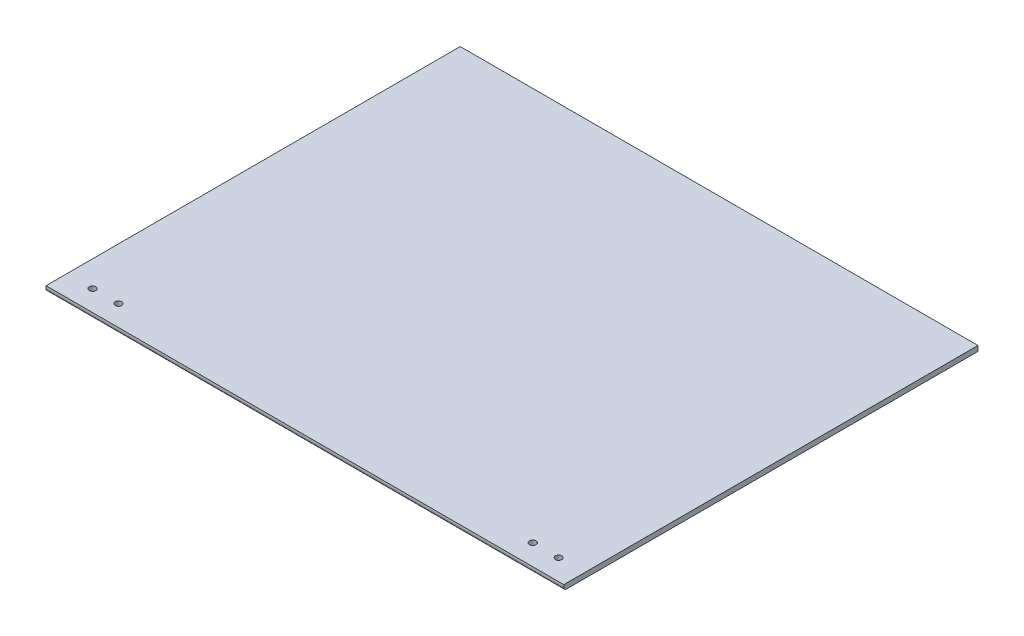
from build123d import *

# Parameters (mm, degrees)
SKETCH1_W           = 500
SKETCH1_H           = 400
BOSS_EXTRUDE1_DEPTH = 5
SKETCH3_R           = 3.175
CUT_EXTRUDE1_DEPTH  = 10
FILLET1_R           = 2.5


with BuildPart() as part:
    # Sketch1 → Boss-Extrude1 (new body)
    with BuildSketch(Plane(origin=(0, 0, 0), x_dir=(1, 0, 0), z_dir=(0, 1, 0))):
        with Locations((250, 200)):
            Rectangle(SKETCH1_W, SKETCH1_H)
    extrude(amount=BOSS_EXTRUDE1_DEPTH)

    # Sketch3 → Cut-Extrude1 (cut)
    with BuildSketch(Plane(origin=(0, 5, 0), x_dir=(1, 0, 0), z_dir=(0, 1, 0))):
        with Locations(Location((25, 20, 0), (0, 0, 270))):
            Circle(SKETCH3_R)
        with Locations(Location((50, 20, 0), (0, 0, 270))):
            Circle(SKETCH3_R)
        with Locations(Location((475, 20, 0), (0, 0, 270))):
            Circle(SKETCH3_R)
        with Locations(Location((450, 20, 0), (0, 0, 270))):
            Circle(SKETCH3_R)
    extrude(amount=-CUT_EXTRUDE1_DEPTH, mode=Mode.SUBTRACT)

    # Fillet1
    fillet1_edges = [part.edges().sort_by_distance(p)[0] for p in [
        (250, 0, 0),
    ]]
    fillet(fillet1_edges, radius=FILLET1_R)


solid = part.part
